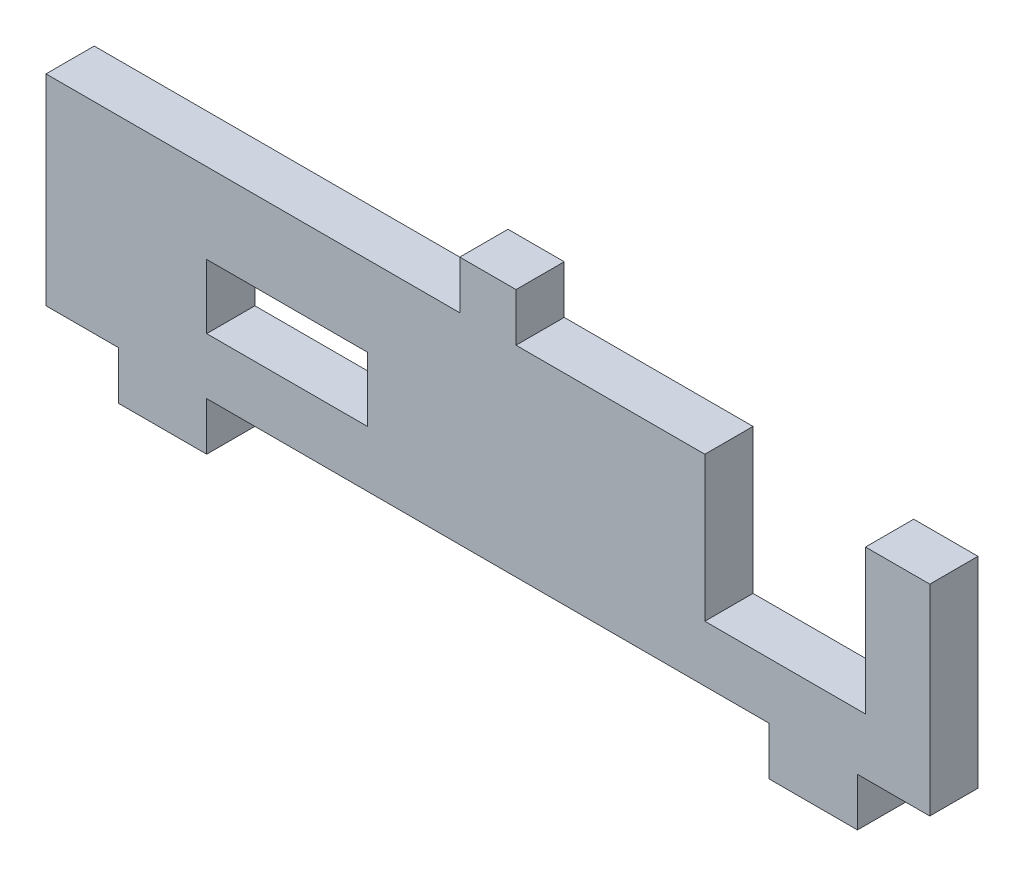
from build123d import *

# Parameters (mm, degrees)
CROQUIS1_W              = 10
CROQUIS1_H              = 4
SALIENTE_EXTRUIR2_DEPTH = 3


with BuildPart() as part:
    # Croquis1 → Saliente-Extruir2 (new body)
    with BuildSketch(Plane.XY):
        Polygon((-17.5, -6.25), (17.5, -6.25), (17.5, -9.25), (23, -9.25), (23, -6.25), (27.5, -6.25), (27.5, 6.25), (23.5, 6.25), (23.5, -2.75), (13.5, -2.75), (13.5, 6.25), (1.75, 6.25), (1.75, 9.25), (-1.75, 9.25), (-1.75, 6.25), (-27.5, 6.25), (-27.5, -6.25), (-23, -6.25), (-23, -9.25), (-17.5, -9.25), align=None)
        with Locations((-12.5, -0.75)):
            Rectangle(CROQUIS1_W, CROQUIS1_H, mode=Mode.SUBTRACT)
    extrude(amount=SALIENTE_EXTRUIR2_DEPTH)


solid = part.part
